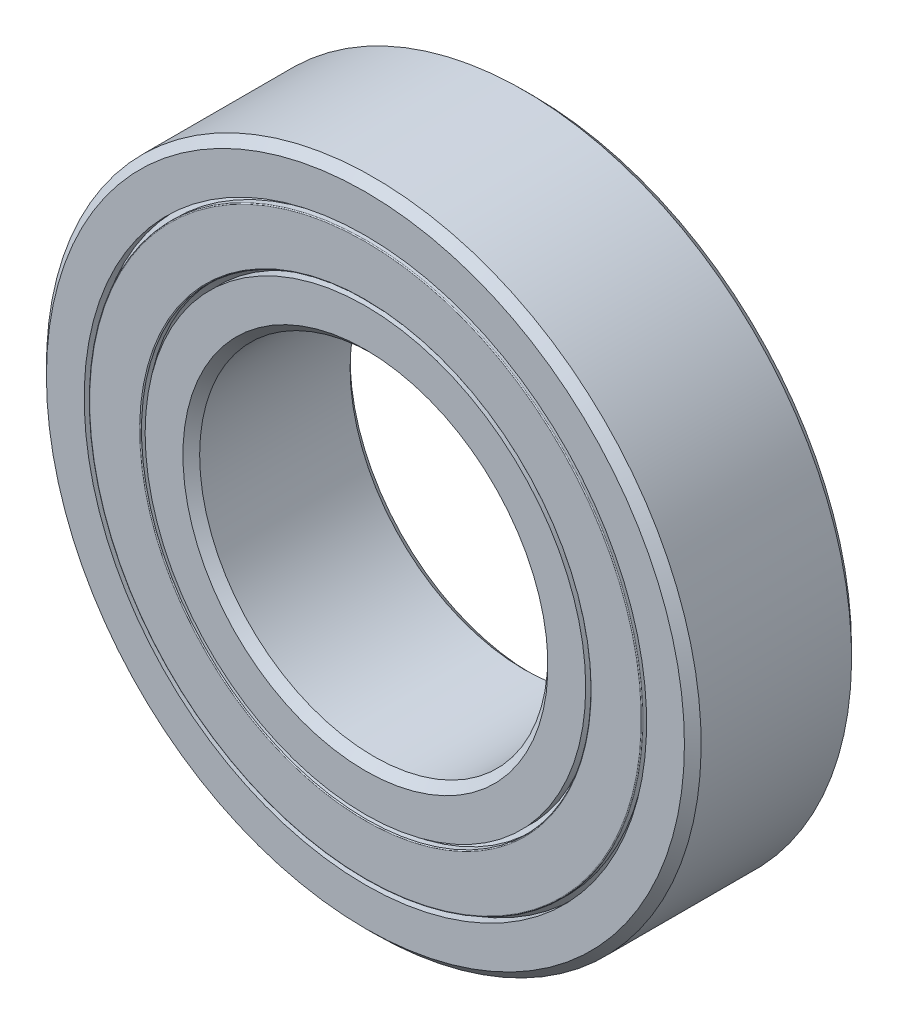
from build123d import *

# Parameters (mm, degrees)
CIRPATTERN1_COUNT   = 10
SKETCH7_R           = 19.09375
SKETCH7_R_2         = 18
BOSS_EXTRUDE1_DEPTH = 1
FILLET1_R           = 0.066666667
FILLET2_R           = 0.066666667


with BuildPart() as part:
    # Sketch3 → Revolve1 (revolve)
    with BuildSketch(Plane(origin=(0, 0, 0), x_dir=(0, 0, -1), z_dir=(1, 0, 0)), mode=Mode.PRIVATE) as revolve1_sk:
        with BuildLine():
            Line((5.4, 23.5), (6, 22.9))
            Line((6, 22.9), (6, 20.1875))
            Line((6, 20.1875), (2.666666667, 20.1875))
            ThreePointArc((2.666666667, 20.1875), (0, 21.449096601), (-2.666666667, 20.1875))
            Line((-2.666666667, 20.1875), (-6, 20.1875))
            Line((-6, 20.1875), (-6, 22.9))
            Line((-6, 22.9), (-5.4, 23.5))
            Line((-5.4, 23.5), (5.4, 23.5))
        make_face()
    revolve(revolve1_sk.sketch.rotate(Axis((0, 0, 6), (0, 0, -1)), 180), axis=Axis((0, 0, 6), (0, 0, -1)))


with BuildPart() as body_2:
    # Sketch4 → Revolve2 (revolve)
    with BuildSketch(Plane(origin=(0, 0, 0), x_dir=(0, 0, -1), z_dir=(1, 0, 0)), mode=Mode.PRIVATE) as revolve2_sk:
        with BuildLine():
            Line((-5.4, 12.5), (-6, 13.1))
            Line((-6, 13.1), (-6, 15.8125))
            Line((-6, 15.8125), (-2.666666667, 15.8125))
            ThreePointArc((-2.666666667, 15.8125), (0, 14.550903399), (2.666666667, 15.8125))
            Line((2.666666667, 15.8125), (6, 15.8125))
            Line((6, 15.8125), (6, 13.1))
            Line((6, 13.1), (5.4, 12.5))
            Line((5.4, 12.5), (-5.4, 12.5))
        make_face()
    revolve(revolve2_sk.sketch.rotate(Axis((0, 0, 6), (0, 0, -1)), 180), axis=Axis((0, 0, 6), (0, 0, -1)))


with BuildPart() as body_3:
    # Sketch5 → Revolve3 (revolve)
    with BuildSketch(Plane(origin=(0, 0, 0), x_dir=(0, 0, -1), z_dir=(1, 0, 0))):
        with BuildLine():
            Line((-3.449096601, 18), (3.449096601, 18))
            ThreePointArc((3.449096601, 18), (0, 21.449096601), (-3.449096601, 18))
        make_face()
    revolve(axis=Axis((0, 18, 3.449096601), (0, 0, -1)))


with BuildPart() as body_4:
    # Sketch6 → Revolve4 (revolve)
    with BuildSketch(Plane(origin=(0, 0, 0), x_dir=(0, 0, -1), z_dir=(1, 0, 0))):
        with BuildLine():
            Line((-3.27108213, 19.09375), (-3.725901775, 19.09375))
            ThreePointArc((-3.725901775, 19.09375), (-3.953311597, 18), (-3.725901775, 16.90625))
            Line((-3.725901775, 16.90625), (-3.27108213, 16.90625))
            ThreePointArc((-3.27108213, 16.90625), (-3.449096601, 18), (-3.27108213, 19.09375))
        make_face()
    revolve(axis=Axis((0, 23.5, 0), (0, -1, 0)))


with BuildPart() as cirpattern1_1:
    # CirPattern1: pattern copy
    add(body_4.part.rotate(Axis((0, 0, 0), (0, 0, 1)), 1 * 360 / CIRPATTERN1_COUNT))


with BuildPart() as cirpattern1_2:
    # CirPattern1: pattern copy
    add(body_4.part.rotate(Axis((0, 0, 0), (0, 0, 1)), 2 * 360 / CIRPATTERN1_COUNT))


with BuildPart() as cirpattern1_3:
    # CirPattern1: pattern copy
    add(body_4.part.rotate(Axis((0, 0, 0), (0, 0, 1)), 3 * 360 / CIRPATTERN1_COUNT))


with BuildPart() as cirpattern1_4:
    # CirPattern1: pattern copy
    add(body_4.part.rotate(Axis((0, 0, 0), (0, 0, 1)), 4 * 360 / CIRPATTERN1_COUNT))


with BuildPart() as cirpattern1_5:
    # CirPattern1: pattern copy
    add(body_4.part.rotate(Axis((0, 0, 0), (0, 0, 1)), 5 * 360 / CIRPATTERN1_COUNT))


with BuildPart() as cirpattern1_6:
    # CirPattern1: pattern copy
    add(body_4.part.rotate(Axis((0, 0, 0), (0, 0, 1)), 6 * 360 / CIRPATTERN1_COUNT))


with BuildPart() as cirpattern1_7:
    # CirPattern1: pattern copy
    add(body_4.part.rotate(Axis((0, 0, 0), (0, 0, 1)), 7 * 360 / CIRPATTERN1_COUNT))


with BuildPart() as cirpattern1_8:
    # CirPattern1: pattern copy
    add(body_4.part.rotate(Axis((0, 0, 0), (0, 0, 1)), 8 * 360 / CIRPATTERN1_COUNT))


with BuildPart() as cirpattern1_9:
    # CirPattern1: pattern copy
    add(body_4.part.rotate(Axis((0, 0, 0), (0, 0, 1)), 9 * 360 / CIRPATTERN1_COUNT))


with BuildPart() as cirpattern1_10:
    # CirPattern1: pattern copy
    add(body_3.part.rotate(Axis((0, 0, 0), (0, 0, 1)), 1 * 360 / CIRPATTERN1_COUNT))


with BuildPart() as cirpattern1_11:
    # CirPattern1: pattern copy
    add(body_3.part.rotate(Axis((0, 0, 0), (0, 0, 1)), 2 * 360 / CIRPATTERN1_COUNT))


with BuildPart() as cirpattern1_12:
    # CirPattern1: pattern copy
    add(body_3.part.rotate(Axis((0, 0, 0), (0, 0, 1)), 3 * 360 / CIRPATTERN1_COUNT))


with BuildPart() as cirpattern1_13:
    # CirPattern1: pattern copy
    add(body_3.part.rotate(Axis((0, 0, 0), (0, 0, 1)), 4 * 360 / CIRPATTERN1_COUNT))


with BuildPart() as cirpattern1_14:
    # CirPattern1: pattern copy
    add(body_3.part.rotate(Axis((0, 0, 0), (0, 0, 1)), 5 * 360 / CIRPATTERN1_COUNT))


with BuildPart() as cirpattern1_15:
    # CirPattern1: pattern copy
    add(body_3.part.rotate(Axis((0, 0, 0), (0, 0, 1)), 6 * 360 / CIRPATTERN1_COUNT))


with BuildPart() as cirpattern1_16:
    # CirPattern1: pattern copy
    add(body_3.part.rotate(Axis((0, 0, 0), (0, 0, 1)), 7 * 360 / CIRPATTERN1_COUNT))


with BuildPart() as cirpattern1_17:
    # CirPattern1: pattern copy
    add(body_3.part.rotate(Axis((0, 0, 0), (0, 0, 1)), 8 * 360 / CIRPATTERN1_COUNT))


with BuildPart() as cirpattern1_18:
    # CirPattern1: pattern copy
    add(body_3.part.rotate(Axis((0, 0, 0), (0, 0, 1)), 9 * 360 / CIRPATTERN1_COUNT))


with BuildPart() as body_23:
    # Sketch7 → Boss-Extrude1 (new, symmetric)
    with BuildSketch(Plane.XY):
        Circle(SKETCH7_R)
        Circle(SKETCH7_R_2, mode=Mode.SUBTRACT)
    extrude(amount=BOSS_EXTRUDE1_DEPTH, both=True)


with BuildPart() as body_24:
    # Sketch8 → Revolve5 (revolve)
    with BuildSketch(Plane(origin=(0, 0, 0), x_dir=(0, 0, -1), z_dir=(1, 0, 0)), mode=Mode.PRIVATE) as revolve5_sk:
        Polygon((-6, 19.859375), (-5.555555556, 19.859375), (-5.333333333, 20.1875), (-5.333333333, 19.859375), (-5.333333333, 16.140625), (-5.333333333, 15.8125), (-5.555555556, 16.140625), (-6, 16.140625), align=None)
        Polygon((6, 19.859375), (6, 16.140625), (5.555555556, 16.140625), (5.333333333, 15.8125), (5.333333333, 16.140625), (5.333333333, 19.859375), (5.333333333, 20.1875), (5.555555556, 19.859375), align=None)
    revolve(revolve5_sk.sketch.rotate(Axis((0, 0, 6), (0, 0, -1)), 180), axis=Axis((0, 0, 6), (0, 0, -1)))

    # Fillet1
    fillet1_edges = [body_24.edges().sort_by_distance(p)[0] for p in [
        (0, 19.859375, 6),
        (0, 16.140625, 6),
    ]]
    fillet(fillet1_edges, radius=FILLET1_R)

    # Fillet2
    fillet2_edges = [body_24.edges().sort_by_distance(p)[0] for p in [
        (0, 19.859375, -6),
        (0, 16.140625, -6),
    ]]
    fillet(fillet2_edges, radius=FILLET2_R)


solid = Compound([part.part, body_2.part, body_3.part, body_4.part, cirpattern1_1.part, cirpattern1_2.part, cirpattern1_3.part, cirpattern1_4.part, cirpattern1_5.part, cirpattern1_6.part, cirpattern1_7.part, cirpattern1_8.part, cirpattern1_9.part, cirpattern1_10.part, cirpattern1_11.part, cirpattern1_12.part, cirpattern1_13.part, cirpattern1_14.part, cirpattern1_15.part, cirpattern1_16.part, cirpattern1_17.part, cirpattern1_18.part, body_23.part, body_24.part])
